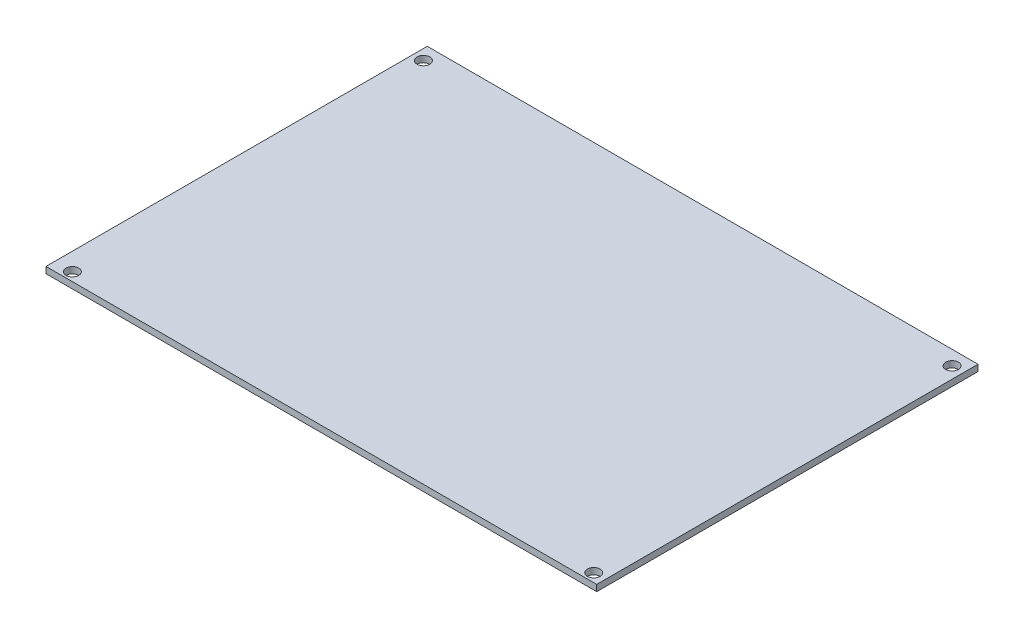
from build123d import *

# Parameters (mm, degrees)
SKETCH1_W           = 130
SKETCH1_H           = 90
BOSS_EXTRUDE1_DEPTH = 1.5
SKETCH2_R           = 1.5
CUT_EXTRUDE1_DEPTH  = 80.071170473


with BuildPart() as part:
    # Sketch1 → Boss-Extrude1 (new body)
    with BuildSketch(Plane(origin=(0, 0, 0), x_dir=(1, 0, 0), z_dir=(0, 1, 0))):
        Rectangle(SKETCH1_W, SKETCH1_H)
    extrude(amount=BOSS_EXTRUDE1_DEPTH)

    # Sketch2 → Cut-Extrude1 (cut, through all)
    with BuildSketch(Plane(origin=(0, 1.5, 0), x_dir=(1, 0, 0), z_dir=(0, 1, 0))):
        with Locations(Location((-62.52981881, 41.618872909, 0), (0, 0, 270))):
            Circle(SKETCH2_R)
        with Locations(Location((62.259126954, 41.618872909, 0), (0, 0, 270))):
            Circle(SKETCH2_R)
        with Locations(Location((62.259126954, -42.972332191, 0), (0, 0, 270))):
            Circle(SKETCH2_R)
        with Locations(Location((-60.796545224, -42.972332191, 0), (0, 0, 270))):
            Circle(SKETCH2_R)
    extrude(amount=-CUT_EXTRUDE1_DEPTH, mode=Mode.SUBTRACT)


solid = part.part
